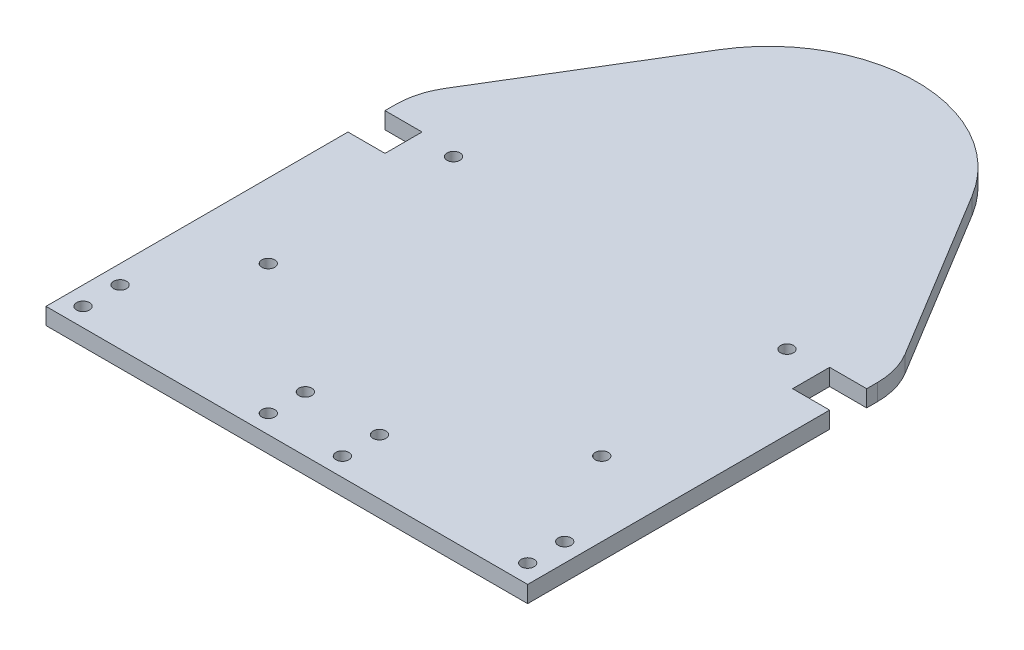
from build123d import *

# Parameters (mm, degrees)
EXTRUDE_1_DEPTH     = 4.5
FILLET_1_R          = 20
SKETCH_2_W          = 10
SKETCH_2_H          = 10
CUT_EXTRUDE_1_DEPTH = 116.19657113
SKETCH_3_R          = 1.75
CUT_EXTRUDE_2_DEPTH = 116.19657113


with BuildPart() as part:
    # 스케치1 → 보스-돌출1 (new body)
    with BuildSketch(Plane(origin=(0, 0, 0), x_dir=(1, 0, 0), z_dir=(0, 1, 0))):
        with BuildLine():
            Line((-65, 25), (-34.194351712, 75.754428709))
            ThreePointArc((-34.194351712, 75.754428709), (0, 95), (34.194351712, 75.754428709))
            Line((34.194351712, 75.754428709), (65, 25))
            Line((65, 25), (65, -75))
            Line((65, -75), (-65, -75))
            Line((-65, -75), (-65, 25))
        make_face()
    extrude(amount=EXTRUDE_1_DEPTH)

    # 필렛1
    fillet_1_edges = [part.edges().sort_by_distance(p)[0] for p in [
        (-65, 2.25, -25),
        (65, 2.25, -25),
    ]]
    fillet(fillet_1_edges, radius=FILLET_1_R)

    # 스케치2 → 컷-돌출1 (cut, through all)
    with BuildSketch(Plane(origin=(0, 4.5, 0), x_dir=(1, 0, 0), z_dir=(0, 1, 0))):
        with Locations((-60, 11.5)):
            Rectangle(SKETCH_2_W, SKETCH_2_H)
        with Locations((60, 11.5)):
            Rectangle(SKETCH_2_W, SKETCH_2_H)
    extrude(amount=-CUT_EXTRUDE_1_DEPTH, mode=Mode.SUBTRACT)

    # 스케치3 → 컷-돌출2 (cut, through all)
    with BuildSketch(Plane(origin=(0, 4.5, 0), x_dir=(1, 0, 0), z_dir=(0, 1, 0))):
        with Locations(Location((-60, -60, 0), (0, 0, 270))):
            Circle(SKETCH_3_R)
        with Locations(Location((-60, -70, 0), (0, 0, 270))):
            Circle(SKETCH_3_R)
        with Locations(Location((60, -60, 0), (0, 0, 270))):
            Circle(SKETCH_3_R)
        with Locations(Location((60, -70, 0), (0, 0, 270))):
            Circle(SKETCH_3_R)
        with Locations(Location((-10, -60, 0), (0, 0, 270))):
            Circle(SKETCH_3_R)
        with Locations(Location((10, -60, 0), (0, 0, 270))):
            Circle(SKETCH_3_R)
        with Locations(Location((-10, -70, 0), (0, 0, 270))):
            Circle(SKETCH_3_R)
        with Locations(Location((10, -70, 0), (0, 0, 270))):
            Circle(SKETCH_3_R)
        with Locations(Location((-45, 15, 0), (0, 0, 270))):
            Circle(SKETCH_3_R)
        with Locations(Location((45, 15, 0), (0, 0, 270))):
            Circle(SKETCH_3_R)
        with Locations(Location((-45, -35, 0), (0, 0, 270))):
            Circle(SKETCH_3_R)
        with Locations(Location((45, -35, 0), (0, 0, 270))):
            Circle(SKETCH_3_R)
    extrude(amount=-CUT_EXTRUDE_2_DEPTH, mode=Mode.SUBTRACT)


solid = part.part
